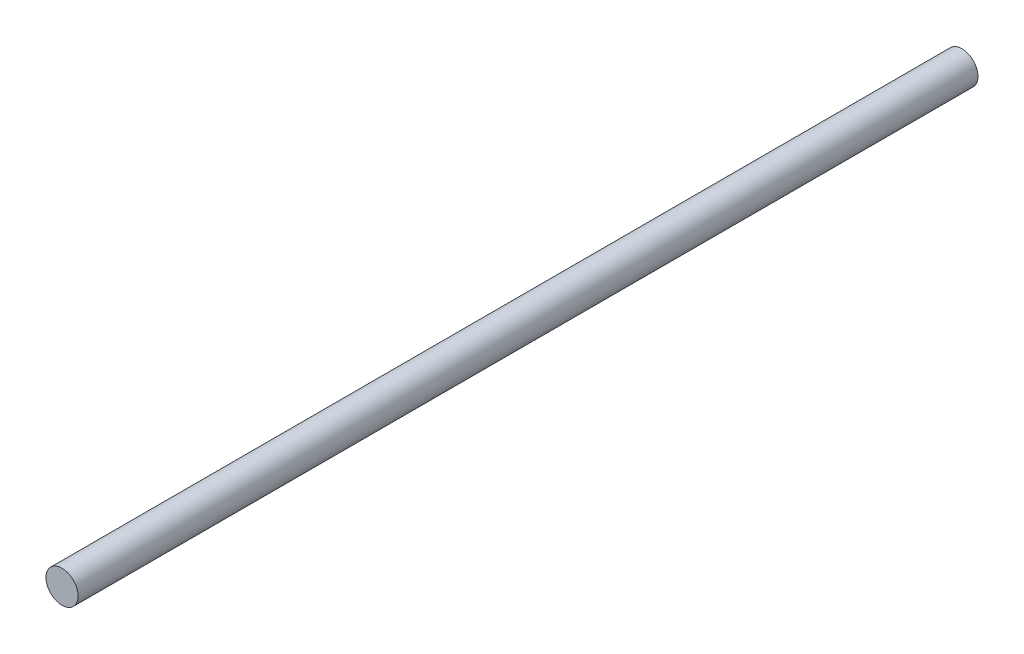
from build123d import *

# Parameters (mm, degrees)
ESQUISSE1_R        = 4
BOSS_EXTRU_1_DEPTH = 224


with BuildPart() as part:
    # Esquisse1 → Boss.-Extru.1 (new body)
    with BuildSketch(Plane.XY):
        Circle(ESQUISSE1_R)
    extrude(amount=BOSS_EXTRU_1_DEPTH)


solid = part.part
